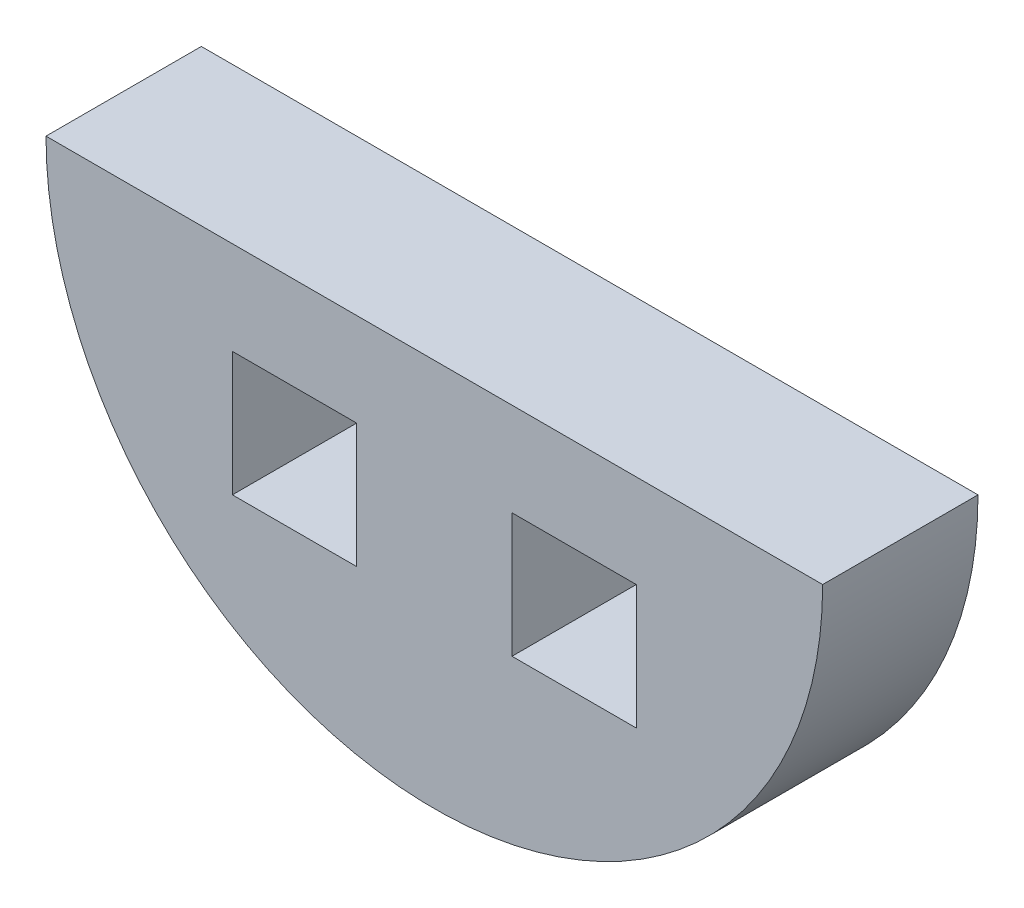
from build123d import *

# Parameters (mm, degrees)
SKETCH1_W           = 20
SKETCH1_H           = 20
BOSS_EXTRUDE1_DEPTH = 25


with BuildPart() as part:
    # Sketch1 → Boss-Extrude1 (new body)
    with BuildSketch(Plane.XY):
        with BuildLine():
            Line((-125, 0), (0, 0))
            ThreePointArc((0, 0), (-62.5, -62.5), (-125, 0))
        make_face()
        with Locations((-40, -25)):
            Rectangle(SKETCH1_W, SKETCH1_H, mode=Mode.SUBTRACT)
        with Locations((-85, -25)):
            Rectangle(SKETCH1_W, SKETCH1_H, mode=Mode.SUBTRACT)
    extrude(amount=BOSS_EXTRUDE1_DEPTH)


solid = part.part
